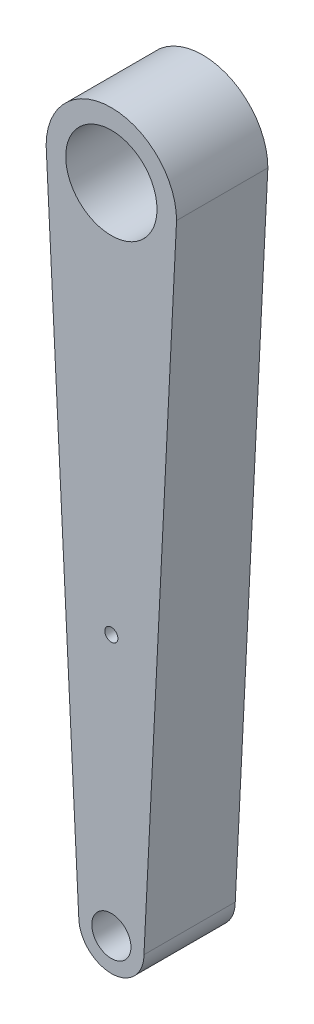
from build123d import *

# Parameters (mm, degrees)
SKETCH1_R           = 1.5
SKETCH1_R_2         = 0.5
SKETCH1_R_3         = 3.5
BOSS_EXTRUDE1_DEPTH = 7
SKETCH1_4_R         = 0.5
BOSS_EXTRUDE2_DEPTH = 5
SKETCH1_5_R         = 0.5
CUT_EXTRUDE3_DEPTH  = 17


with BuildPart() as part:
    # Sketch1 → Boss-Extrude1 (new body)
    with BuildSketch(Plane.XY):
        with BuildLine():
            Line((4.975062344, 29.501246883), (5, 30))
            ThreePointArc((5, 30), (0, 35), (-5, 30))
            Line((-5, 30), (-4.975062344, 29.501246883))
            Line((-4.975062344, 29.501246883), (-2.5, -20))
            ThreePointArc((-2.5, -20), (0, -22.5), (2.5, -20))
            Line((2.5, -20), (4.975062344, 29.501246883))
        make_face()
        with Locations((0, -20)):
            Circle(SKETCH1_R, mode=Mode.SUBTRACT)
        Circle(SKETCH1_R_2, mode=Mode.SUBTRACT)
        with Locations((0, 30)):
            Circle(SKETCH1_R_3, mode=Mode.SUBTRACT)
    extrude(amount=BOSS_EXTRUDE1_DEPTH)

    # Sketch1<4> → Boss-Extrude2 (add)
    with BuildSketch(Plane.XY):
        Circle(SKETCH1_4_R)
    extrude(amount=BOSS_EXTRUDE2_DEPTH)

    # Sketch1<5> → Cut-Extrude3 (cut)
    with BuildSketch(Plane.XY):
        Circle(SKETCH1_5_R)
    extrude(amount=CUT_EXTRUDE3_DEPTH, mode=Mode.SUBTRACT)


solid = part.part
